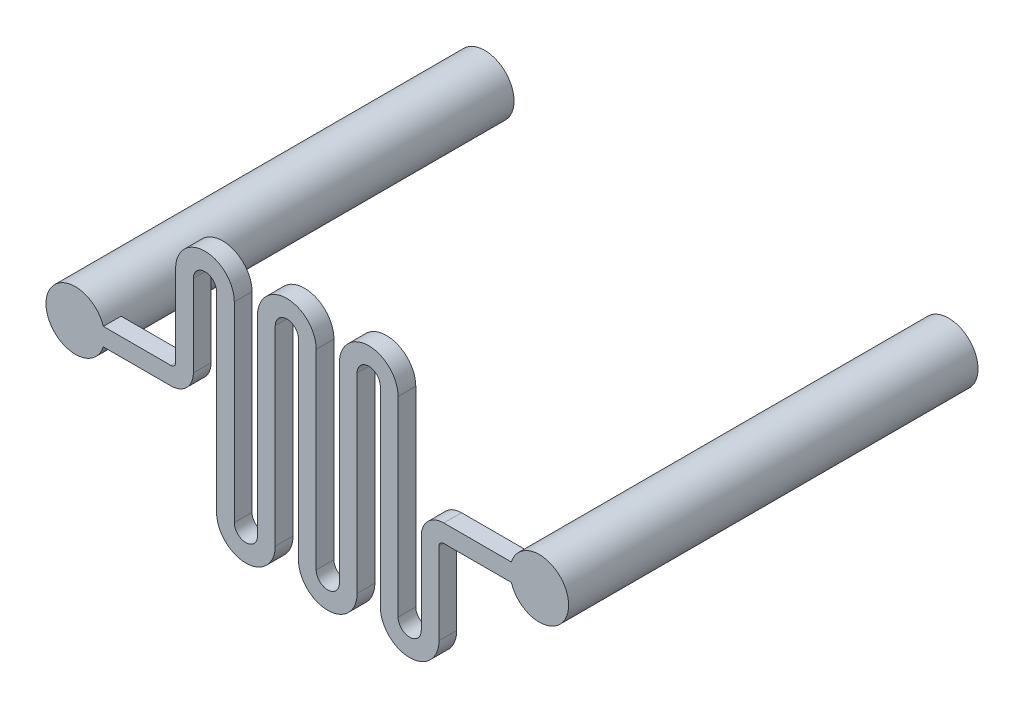
from build123d import *

# Parameters (mm, degrees)
BOSS_EXTRUDE1_DEPTH = 1.3
SKETCH3_W           = 2.15
SKETCH3_H           = 30
SKETCH4_W           = 2.15
SKETCH4_H           = 30
SKETCH5_R           = 1.5
CUT_EXTRUDE1_DEPTH  = 28


with BuildPart() as part:
    # Sketch2 → Boss-Extrude1 (new body)
    with BuildSketch(Plane.XY):
        with BuildLine():
            Line((-20.5, -0.65), (-13.5, -0.65))
            ThreePointArc((-13.5, -0.65), (-12.333273811, -0.166726189), (-11.85, 1))
            Line((-11.85, 1), (-11.85, 7))
            ThreePointArc((-11.85, 7), (-11, 7.85), (-10.15, 7))
            Line((-10.15, 7), (-10.15, 0))
            Line((-10.15, 0), (-10.15, -7))
            ThreePointArc((-10.15, -7), (-8, -9.15), (-5.85, -7))
            Line((-5.85, -7), (-5.85, 0))
            Line((-5.85, 0), (-5.85, 7))
            ThreePointArc((-5.85, 7), (-5, 7.85), (-4.15, 7))
            Line((-4.15, 7), (-4.15, 0))
            Line((-4.15, 0), (-4.15, -7))
            ThreePointArc((-4.15, -7), (-2, -9.15), (0.15, -7))
            Line((0.15, -7), (0.15, 0))
            Line((0.15, 0), (0.15, 7))
            ThreePointArc((0.15, 7), (1, 7.85), (1.85, 7))
            Line((1.85, 7), (1.85, 0))
            Line((1.85, 0), (1.85, -7))
            ThreePointArc((1.85, -7), (4, -9.15), (6.15, -7))
            Line((6.15, -7), (6.15, -1))
            ThreePointArc((6.15, -1), (6.252512627, -0.752512627), (6.5, -0.65))
            Line((6.5, -0.65), (13.5, -0.65))
            ThreePointArc((13.5, -0.65), (14.15, 0), (13.5, 0.65))
            Line((13.5, 0.65), (6.5, 0.65))
            ThreePointArc((6.5, 0.65), (5.333273811, 0.166726189), (4.85, -1))
            Line((4.85, -1), (4.85, -7))
            ThreePointArc((4.85, -7), (4, -7.85), (3.15, -7))
            Line((3.15, -7), (3.15, 0))
            Line((3.15, 0), (3.15, 7))
            ThreePointArc((3.15, 7), (1, 9.15), (-1.15, 7))
            Line((-1.15, 7), (-1.15, 0))
            Line((-1.15, 0), (-1.15, -7))
            ThreePointArc((-1.15, -7), (-2, -7.85), (-2.85, -7))
            Line((-2.85, -7), (-2.85, 0))
            Line((-2.85, 0), (-2.85, 7))
            ThreePointArc((-2.85, 7), (-5, 9.15), (-7.15, 7))
            Line((-7.15, 7), (-7.15, 0))
            Line((-7.15, 0), (-7.15, -7))
            ThreePointArc((-7.15, -7), (-8, -7.85), (-8.85, -7))
            Line((-8.85, -7), (-8.85, 0))
            Line((-8.85, 0), (-8.85, 7))
            ThreePointArc((-8.85, 7), (-11, 9.15), (-13.15, 7))
            Line((-13.15, 7), (-13.15, 1))
            ThreePointArc((-13.15, 1), (-13.252512627, 0.752512627), (-13.5, 0.65))
            Line((-13.5, 0.65), (-20.5, 0.65))
            ThreePointArc((-20.5, 0.65), (-21.15, 0), (-20.5, -0.65))
        make_face()
    extrude(amount=BOSS_EXTRUDE1_DEPTH)

    # Sketch3 → Revolve1 (revolve)
    with BuildSketch(Plane(origin=(0, 0, 0), x_dir=(1, 0, 0), z_dir=(0, 1, 0)), mode=Mode.PRIVATE) as revolve1_sk:
        with Locations((-21.575, 13.7)):
            Rectangle(SKETCH3_W, SKETCH3_H)
    revolve(revolve1_sk.sketch.rotate(Axis((-20.5, 0, 1.3), (0, 0, -1)), 180), axis=Axis((-20.5, 0, 1.3), (0, 0, -1)))

    # Sketch4 → Revolve2 (revolve)
    with BuildSketch(Plane(origin=(0, 0, 0), x_dir=(1, 0, 0), z_dir=(0, 1, 0))):
        with Locations((14.575, 13.7)):
            Rectangle(SKETCH4_W, SKETCH4_H)
    revolve(axis=Axis((13.5, 0, 1.3), (0, 0, -1)))

    # Sketch5 → Cut-Extrude1 (cut)
    with BuildSketch(Plane(origin=(0, 0, -28.7), x_dir=(-1, 0, 0), z_dir=(0, 0, -1))):
        with Locations((-13.5, 0)):
            Circle(SKETCH5_R)
        with Locations((20.5, 0)):
            Circle(SKETCH5_R)
    extrude(amount=-CUT_EXTRUDE1_DEPTH, mode=Mode.SUBTRACT)


solid = part.part
